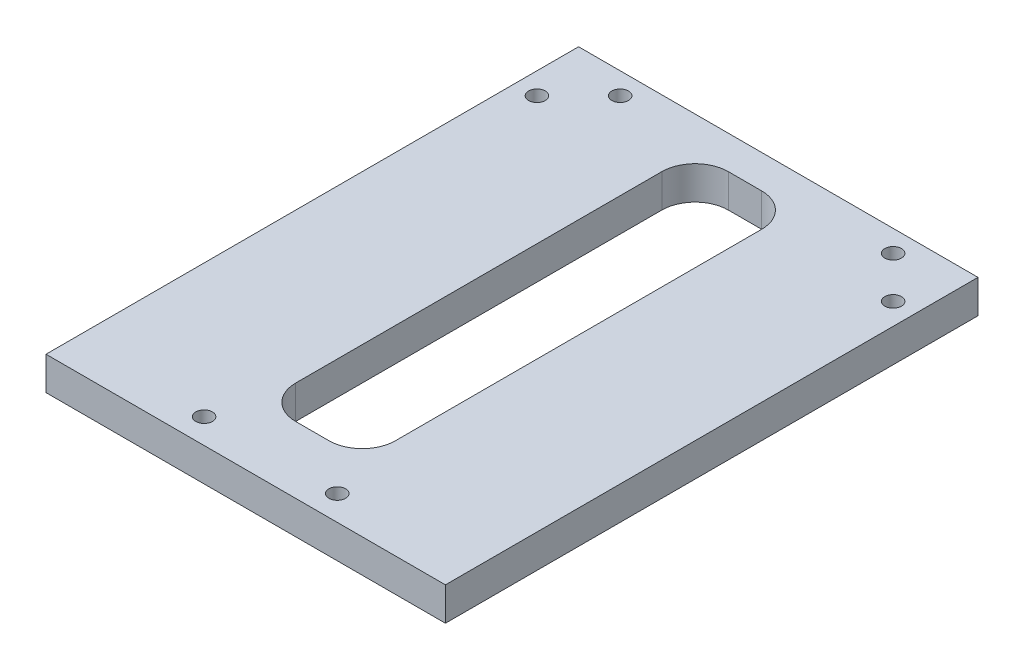
from build123d import *

# Parameters (mm, degrees)
BOSS_EXTRUDE3_DEPTH = 10
FILLET3_R           = 10
SKETCH2_R           = 2.5
CUT_EXTRUDE1_DEPTH  = 100
SKETCH3_R           = 2.5
CUT_EXTRUDE3_DEPTH  = 100
SKETCH4_R           = 5
CUT_EXTRUDE4_DEPTH  = 5
SKETCH5_R           = 2.25
CUT_EXTRUDE7_DEPTH  = 5
SKETCH8_R           = 2.25
CUT_EXTRUDE8_DEPTH  = 5
SKETCH9_R           = 2.25
CUT_EXTRUDE9_DEPTH  = 5
SKETCH10_R          = 5
CUT_EXTRUDE13_DEPTH = 12
SKETCH12_R          = 2.5
CUT_EXTRUDE14_DEPTH = 12


with BuildPart() as part:
    # Sketch1 → Boss-Extrude3 (new body)
    with BuildSketch(Plane(origin=(0, 0, 0), x_dir=(1, 0, 0), z_dir=(0, 1, 0))):
        Polygon((60, 150), (60, 160), (0, 160), (0, 80), (45, 80), (45, 150), align=None)
        Polygon((120, 160), (60, 160), (60, 150), (75, 150), (75, 80), (120, 80), align=None)
        Polygon((120, 0), (120, 80), (75, 80), (75, 20), (60, 20), (60, 0), align=None)
        Polygon((45, 80), (0, 80), (0, 0), (60, 0), (60, 20), (45, 20), align=None)
    extrude(amount=BOSS_EXTRUDE3_DEPTH)

    # Fillet3
    fillet3_edges = [part.edges().sort_by_distance(p)[0] for p in [
        (75, 5, -150),
        (45, 5, -150),
        (45, 5, -20),
        (75, 5, -20),
    ]]
    fillet(fillet3_edges, radius=FILLET3_R)

    # Sketch2 → Cut-Extrude1 (cut)
    with BuildSketch(Plane(origin=(0, 10, 0), x_dir=(1, 0, 0), z_dir=(0, 1, 0))):
        with Locations(Location((19, 153.5, 0), (0, 0, 270))):
            Circle(SKETCH2_R)
        with Locations(Location((6.5, 141, 0), (0, 0, 270))):
            Circle(SKETCH2_R)
    extrude(amount=-CUT_EXTRUDE1_DEPTH, mode=Mode.SUBTRACT)

    # Sketch3 → Cut-Extrude3 (cut)
    with BuildSketch(Plane(origin=(0, 10, 0), x_dir=(1, 0, 0), z_dir=(0, 1, 0))):
        with Locations(Location((113.5, 141, 0), (0, 0, 270))):
            Circle(SKETCH3_R)
        with Locations(Location((101, 153.5, 0), (0, 0, 270))):
            Circle(SKETCH3_R)
    extrude(amount=-CUT_EXTRUDE3_DEPTH, mode=Mode.SUBTRACT)

    # Sketch4 → Cut-Extrude4 (cut)
    with BuildSketch(Plane.XZ):
        with Locations(Location((113.5, -141, 0), (0, 0, 270))):
            Circle(SKETCH4_R)
        with Locations(Location((101, -153.5, 0), (0, 0, 270))):
            Circle(SKETCH4_R)
        with Locations(Location((19, -153.5, 0), (0, 0, 270))):
            Circle(SKETCH4_R)
        with Locations(Location((6.5, -141, 0), (0, 0, 270))):
            Circle(SKETCH4_R)
    extrude(amount=-CUT_EXTRUDE4_DEPTH, mode=Mode.SUBTRACT)

    # Sketch5 → Cut-Extrude7 (cut)
    with BuildSketch(Plane.XZ):
        with Locations(Location((112.5, -152.5, 0), (0, 0, 270))):
            Circle(SKETCH5_R)
    extrude(amount=-CUT_EXTRUDE7_DEPTH, mode=Mode.SUBTRACT)

    # Sketch8 → Cut-Extrude8 (cut)
    with BuildSketch(Plane(origin=(0, 0, 0), x_dir=(-1, 0, 0), z_dir=(0, -1, 0))):
        with Locations(Location((-7.5, 153.623044918, 0), (0, 0, 90))):
            Circle(SKETCH8_R)
    extrude(amount=-CUT_EXTRUDE8_DEPTH, mode=Mode.SUBTRACT)

    # Sketch9 → Cut-Extrude9 (cut)
    with BuildSketch(Plane(origin=(0, 0, 0), x_dir=(-1, 0, 0), z_dir=(0, -1, 0))):
        with Locations(Location((-7.5, 7.5, 0), (0, 0, 90))):
            Circle(SKETCH9_R)
        with Locations(Location((-112.5, 7.5, 0), (0, 0, 90))):
            Circle(SKETCH9_R)
    extrude(amount=-CUT_EXTRUDE9_DEPTH, mode=Mode.SUBTRACT)

    # Sketch10 → Cut-Extrude13 (cut)
    with BuildSketch(Plane(origin=(0, 5, 0), x_dir=(-1, 0, 0), z_dir=(0, -1, 0))):
        with Locations(Location((-80, 7.5, 0), (0, 0, 270))):
            Circle(SKETCH10_R)
        with Locations(Location((-40, 7.5, 0), (0, 0, 270))):
            Circle(SKETCH10_R)
    extrude(amount=CUT_EXTRUDE13_DEPTH, mode=Mode.SUBTRACT)

    # Sketch12 → Cut-Extrude14 (cut)
    with BuildSketch(Plane(origin=(0, 5, 0), x_dir=(-1, 0, 0), z_dir=(0, -1, 0))):
        with Locations(Location((-80, 7.5, 0), (0, 0, 90))):
            Circle(SKETCH12_R)
        with Locations(Location((-40, 7.5, 0), (0, 0, 90))):
            Circle(SKETCH12_R)
    extrude(amount=-CUT_EXTRUDE14_DEPTH, mode=Mode.SUBTRACT)


solid = part.part
